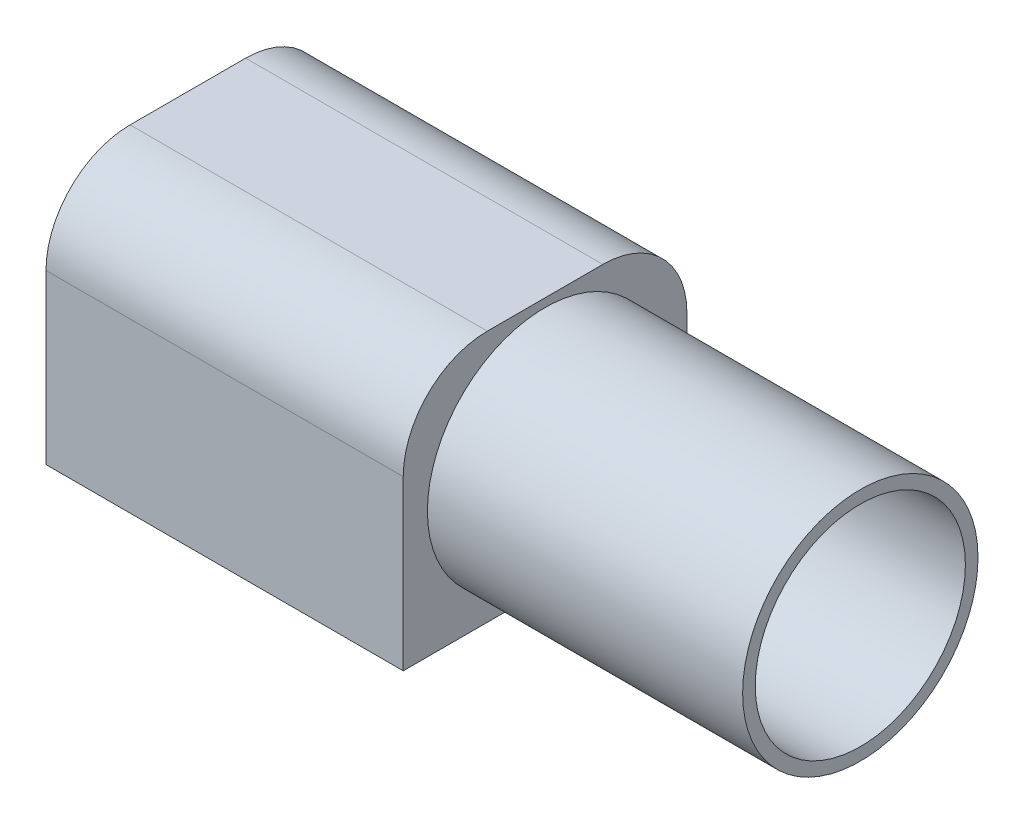
from build123d import *

# Parameters (mm, degrees)
SKETCH1_W           = 17
SKETCH1_H           = 13.5
BOSS_EXTRUDE1_DEPTH = 12
SKETCH2_R           = 5.6
SKETCH2_R_2         = 5
BOSS_EXTRUDE2_DEPTH = 15
FILLET1_R           = 4


with BuildPart() as part:
    # Sketch1 → Boss-Extrude1 (new body)
    with BuildSketch(Plane(origin=(0, 0, 0), x_dir=(1, 0, 0), z_dir=(0, 1, 0))):
        with Locations((-65.845078181, 9.272756488)):
            Rectangle(SKETCH1_W, SKETCH1_H)
    extrude(amount=BOSS_EXTRUDE1_DEPTH)

    # Sketch2 → Boss-Extrude2 (add)
    with BuildSketch(Plane(origin=(-57.345078181, 0, 0), x_dir=(0, 0, -1), z_dir=(1, 0, 0))):
        with Locations(Location((9.272756488, 6, 0), (0, 0, 180))):
            Circle(SKETCH2_R)
        with Locations((9.272756488, 6)):
            Circle(SKETCH2_R_2, mode=Mode.SUBTRACT)
    extrude(amount=BOSS_EXTRUDE2_DEPTH)

    # Fillet1
    fillet1_edges = [part.edges().sort_by_distance(p)[0] for p in [
        (-65.845078181, 12, -16.022756488),
        (-65.845078181, 12, -2.522756488),
    ]]
    fillet(fillet1_edges, radius=FILLET1_R)


solid = part.part
